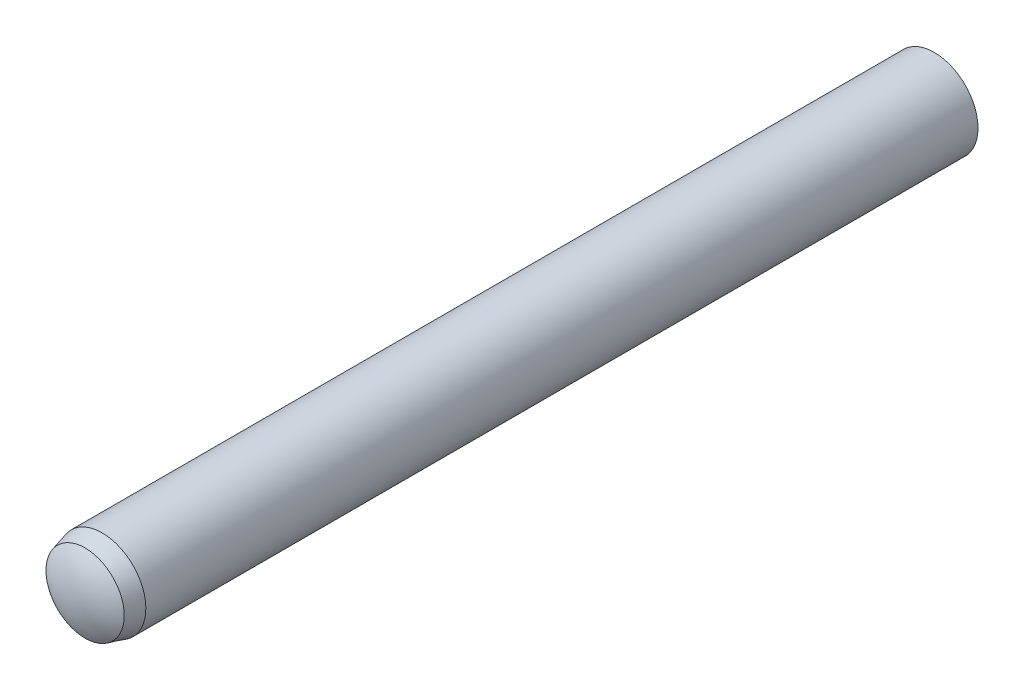
from build123d import *


with BuildPart() as part:
    # Sketch3 → Revolve1 (revolve)
    with BuildSketch(Plane(origin=(0, 0, 0), x_dir=(0, 0, -1), z_dir=(1, 0, 0))):
        with BuildLine():
            Line((-15, 0), (15, 0))
            ThreePointArc((15, 0), (14.885076627, 0.783022988), (14.55, 1.5))
            Line((14.55, 1.5), (-14.025, 1.5))
            Line((-14.025, 1.5), (-14.61, 1.343249722))
            ThreePointArc((-14.61, 1.343249722), (-14.90052754, 0.699360389), (-15, 0))
        make_face()
    revolve(axis=Axis((0, 0, 15), (0, 0, -1)))


solid = part.part
